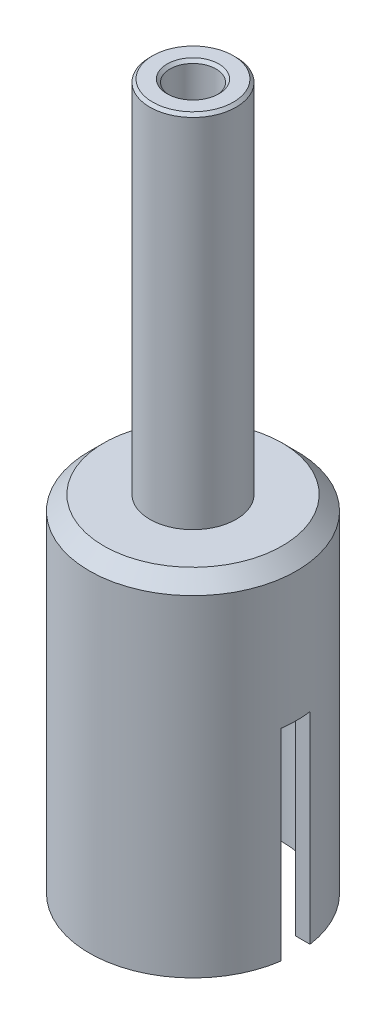
from build123d import *

# Parameters (mm, degrees)
SCHIZZO1_R        = 36
ESTRUSIONE1_DEPTH = 120
SCHIZZO2_R        = 31
ESTRUSIONE2_DEPTH = 110
SMUSSO1_SIZE      = 5
SCHIZZO3_R        = 15
ESTRUSIONE3_DEPTH = 125
SCHIZZO4_R        = 8
ESTRUSIONE4_DEPTH = 251.23389059
SMUSSO2_SIZE      = 1
SCHIZZO5_W        = 88.337421072
SCHIZZO5_H        = 10
ESTRUSIONE5_DEPTH = 70


with BuildPart() as part:
    # Schizzo1 → Estrusione1 (new body)
    with BuildSketch(Plane(origin=(0, 0, 0), x_dir=(1, 0, 0), z_dir=(0, 1, 0))):
        with Locations(Location((0, 0, 0), (0, 0, 270))):
            Circle(SCHIZZO1_R)
    extrude(amount=ESTRUSIONE1_DEPTH)

    # Schizzo2 → Estrusione2 (cut)
    with BuildSketch(Plane.XZ):
        with Locations(Location((0, 0, 0), (0, 0, 270))):
            Circle(SCHIZZO2_R)
    extrude(amount=-ESTRUSIONE2_DEPTH, mode=Mode.SUBTRACT)

    # Smusso1
    smusso1_edges = [part.edges().sort_by_distance(p)[0] for p in [
        (0, 120, -36),
    ]]
    chamfer(smusso1_edges, length=SMUSSO1_SIZE)

    # Schizzo3 → Estrusione3 (add)
    with BuildSketch(Plane(origin=(0, 120, 0), x_dir=(1, 0, 0), z_dir=(0, 1, 0))):
        with Locations(Location((0, 0, 0), (0, 0, 270))):
            Circle(SCHIZZO3_R)
    extrude(amount=ESTRUSIONE3_DEPTH)

    # Schizzo4 → Estrusione4 (cut, through all)
    with BuildSketch(Plane(origin=(0, 245, 0), x_dir=(1, 0, 0), z_dir=(0, 1, 0))):
        with Locations(Location((0, 0, 0), (0, 0, 270))):
            Circle(SCHIZZO4_R)
    extrude(amount=-ESTRUSIONE4_DEPTH, mode=Mode.SUBTRACT)

    # Smusso2
    smusso2_edges = [part.edges().sort_by_distance(p)[0] for p in [
        (0, 245, -15),
        (0, 245, -8),
    ]]
    chamfer(smusso2_edges, length=SMUSSO2_SIZE)

    # Schizzo5 → Estrusione5 (cut)
    with BuildSketch(Plane.XZ):
        Rectangle(SCHIZZO5_W, SCHIZZO5_H)
    extrude(amount=-ESTRUSIONE5_DEPTH, mode=Mode.SUBTRACT)


solid = part.part
